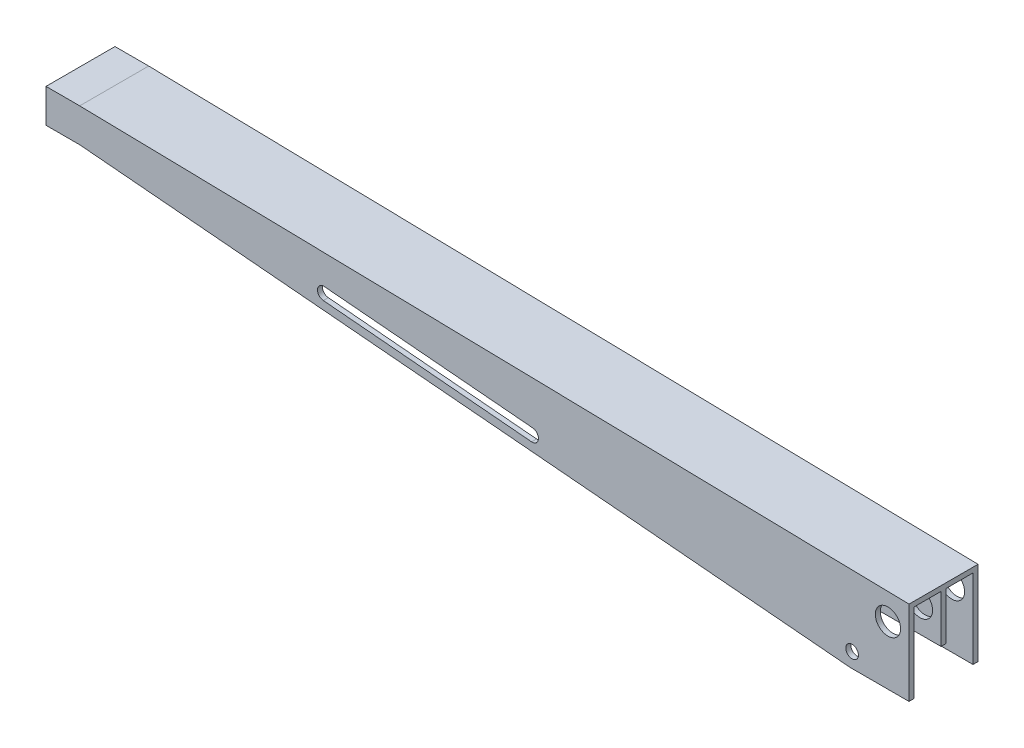
from build123d import *

# Parameters (mm, degrees)
BOSS_EXTRUDE1_DEPTH      = 15
BOSS_EXTRUDE2_DEPTH      = 15
BOSS_EXTRUDE3_DEPTH      = 192.8
BOSS_EXTRUDE4_DEPTH      = 7.5
BOSS_EXTRUDE4_DEPTH_BACK = 7.5
SKETCH5_R                = 38.1
SKETCH5_R_2              = 19.05
CUT_EXTRUDE1_DEPTH       = 2627.039580814
CUT_EXTRUDE2_DEPTH       = 15
CUT_EXTRUDE12_DEPTH      = 60
CUT_EXTRUDE16_DEPTH      = 2627.039580814
CUT_EXTRUDE16_DEPTH_BACK = 2627.039580814
SKETCH16_R               = 19.05
CUT_EXTRUDE17_DEPTH      = 2627.039580814
CUT_EXTRUDE17_DEPTH_BACK = 2627.039580814
SKETCH18_W               = 39.925079479
SKETCH18_H               = 106.526969349
CUT_EXTRUDE18_DEPTH      = 96.4


with BuildPart() as part:
    # Sketch1 → Boss-Extrude1 (new body)
    with BuildSketch(Plane.XY):
        Polygon((-2600, 304.8), (-2498.4, 304.8), (0, 254), (0, 0), (-177.8, 0), (-2498.4, 203.2), (-2600, 203.2), align=None)
    extrude(amount=-BOSS_EXTRUDE1_DEPTH)



with BuildPart() as body_2:
    # Sketch2 → Boss-Extrude2 (new body)
    with BuildSketch(Plane.XY.offset(177.8)):
        Polygon((-2498.4, 203.2), (-177.8, 0), (0, 0), (0, 254), (-2498.4, 304.8), (-2600, 304.8), (-2600, 203.2), align=None)
    extrude(amount=BOSS_EXTRUDE2_DEPTH)


with BuildPart() as part_1:
    add(part.part)

    add(body_2.part)  # Boss-Extrude3 merges body 2
    # Sketch3 → Boss-Extrude3 (add)
    with BuildSketch(Plane.XY.offset(192.8)):
        Polygon((-2600, 289.8), (-2600, 304.8), (-2498.4, 304.8), (0, 254), (0, 238.996899585), (-15, 239.301894782), (-2498.55248184, 289.8), align=None)
    extrude(amount=-BOSS_EXTRUDE3_DEPTH)

    # Sketch6 → Boss-Extrude4 (add, two sides: drawn at the far end of the back side and taken through both)
    with BuildSketch(Plane.XY.offset(88.9).offset(-BOSS_EXTRUDE4_DEPTH_BACK)):
        Polygon((-2498.4, 203.2), (-177.8, 0), (0, 0), (0, 254), (-2498.4, 304.8), (-2600, 304.8), (-2600, 203.2), align=None)
    extrude(amount=BOSS_EXTRUDE4_DEPTH + BOSS_EXTRUDE4_DEPTH_BACK)

    # Sketch5 → Cut-Extrude1 (cut, through all)
    with BuildSketch(Plane.XY.offset(192.8)):
        with Locations((-63.5, 176.782795882)):
            Circle(SKETCH5_R)
        with Locations((-171.45, 44.45)):
            Circle(SKETCH5_R_2)
    extrude(amount=-CUT_EXTRUDE1_DEPTH, mode=Mode.SUBTRACT)

    # Sketch7 → Cut-Extrude2 (cut)
    with BuildSketch(Plane.XY.offset(96.4)):
        Polygon((-1265.58125, 95.25), (0, 95.25), (0, 0), (-177.8, 0), align=None)
    extrude(amount=-CUT_EXTRUDE2_DEPTH, mode=Mode.SUBTRACT)

    # Sketch13 → Cut-Extrude12 (cut)
    with BuildSketch(Plane(origin=(0, 0, 81.4), x_dir=(-1, 0, 0), z_dir=(0, 0, -1))):
        Polygon((2605.267563799, 259.022933261), (2605.624161029, 249.594727716), (2612.822921274, 133.887362854), (1105.756685281, 0), (1095.76383028, 0), (1095.76383028, 94.872046381), (1091.720431016, 201.776969349), (1249.091648094, 207.729124269), align=None)
    extrude(amount=-CUT_EXTRUDE12_DEPTH, mode=Mode.SUBTRACT)

    # Sketch16 → Cut-Extrude16 (cut, two sides: drawn at the far end of the back side and taken through both)
    with BuildSketch(Plane(origin=(0, 0, -15), x_dir=(-1, 0, 0), z_dir=(0, 0, -1)).offset(-CUT_EXTRUDE16_DEPTH_BACK)):
        with Locations((1135.45885, 127.8123918)):
            Circle(SKETCH16_R)
    extrude(amount=CUT_EXTRUDE16_DEPTH + CUT_EXTRUDE16_DEPTH_BACK, mode=Mode.SUBTRACT)

    # Sketch17 → Cut-Extrude17 (cut, two sides: drawn at the far end of the back side and taken through both)
    with BuildSketch(Plane(origin=(0, 0, -15), x_dir=(-1, 0, 0), z_dir=(0, 0, -1)).offset(-CUT_EXTRUDE17_DEPTH_BACK)):
        with BuildLine():
            Line((1133.797122541, 146.789777338), (1761.395699383, 201.744543697))
            ThreePointArc((1761.395699383, 201.744543697), (1782.03481238, 184.428885618), (1764.719154301, 163.789772622))
            Line((1764.719154301, 163.789772622), (1137.120577459, 108.835006262))
            ThreePointArc((1137.120577459, 108.835006262), (1116.481464462, 126.150664341), (1133.797122541, 146.789777338))
        make_face()
    extrude(amount=CUT_EXTRUDE17_DEPTH + CUT_EXTRUDE17_DEPTH_BACK, mode=Mode.SUBTRACT)

    # Sketch18 → Cut-Extrude18 (cut)
    with BuildSketch(Plane(origin=(0, 0, 81.4), x_dir=(-1, 0, 0), z_dir=(0, 0, -1))):
        with Locations((1071.757891277, 148.513484675)):
            Rectangle(SKETCH18_W, SKETCH18_H)
        Polygon((1110.039582386, 201.776969349), (1091.720431016, 201.776969349), (1095.749535172, 95.25), (1091.720431016, 95.25), (1091.720431016, 86.714646079), (1110.039582386, 86.714646079), align=None)
    extrude(amount=-CUT_EXTRUDE18_DEPTH, mode=Mode.SUBTRACT)


with BuildPart() as body_2_2:
    # of the pieces the cut leaves, the one that is kept (cut_extrude18_keep)
    add(part_1.part.solids().sort_by_distance((-2600, 304.8, -15))[0])


solid = body_2_2.part
